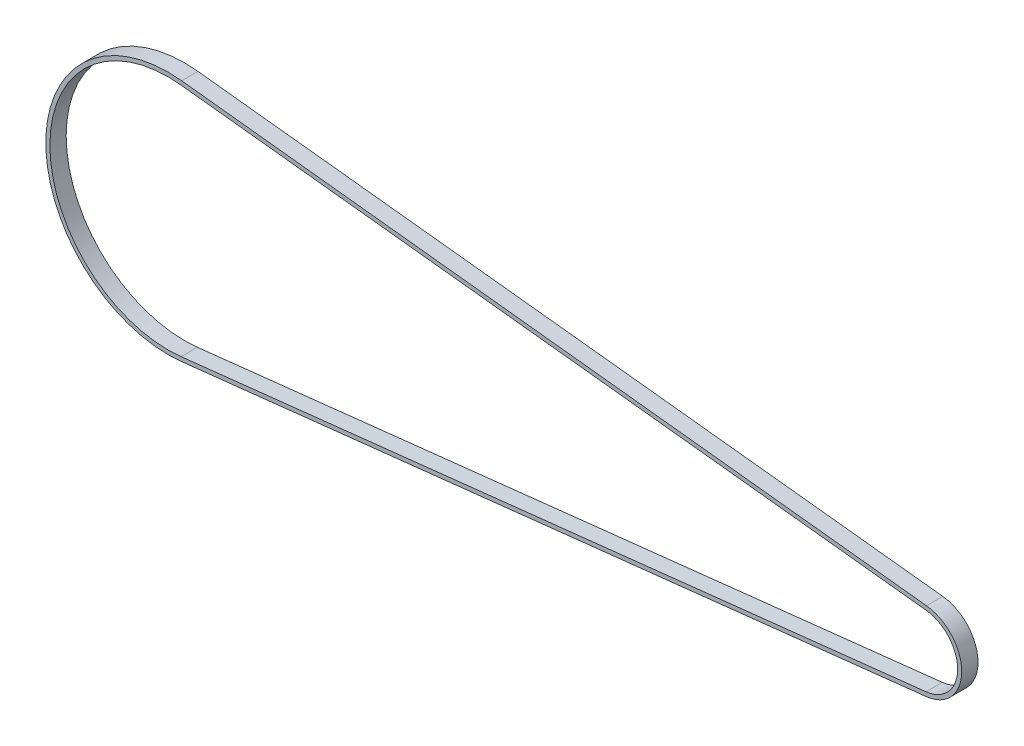
from build123d import *

# Parameters (mm, degrees)
EXTRUDE_THIN1_DEPTH = 19.05


with BuildPart() as part:
    # Sketch1 → Extrude-Thin1 (new body)
    with BuildSketch(Plane.XY):
        with BuildLine():
            Line((887.458647221, -46.08769227), (15.712882063, -142.327781524))
            ThreePointArc((15.712882063, -142.327781524), (-143.1925, 0), (15.712882063, 142.327781524))
            Line((15.712882063, 142.327781524), (887.458647221, 46.08769227))
            ThreePointArc((887.458647221, 46.08769227), (928.7383, 0), (887.458647221, -46.08769227))
        make_face()
        with BuildLine():
            Line((886.936045822, -41.353952308), (15.190280664, -137.594041562))
            ThreePointArc((15.190280664, -137.594041562), (-138.43, 0), (15.190280664, 137.594041562))
            Line((15.190280664, 137.594041562), (886.936045822, 41.353952308))
            ThreePointArc((886.936045822, 41.353952308), (923.9758, 0), (886.936045822, -41.353952308))
        make_face(mode=Mode.SUBTRACT)
    extrude(amount=EXTRUDE_THIN1_DEPTH)


solid = part.part
